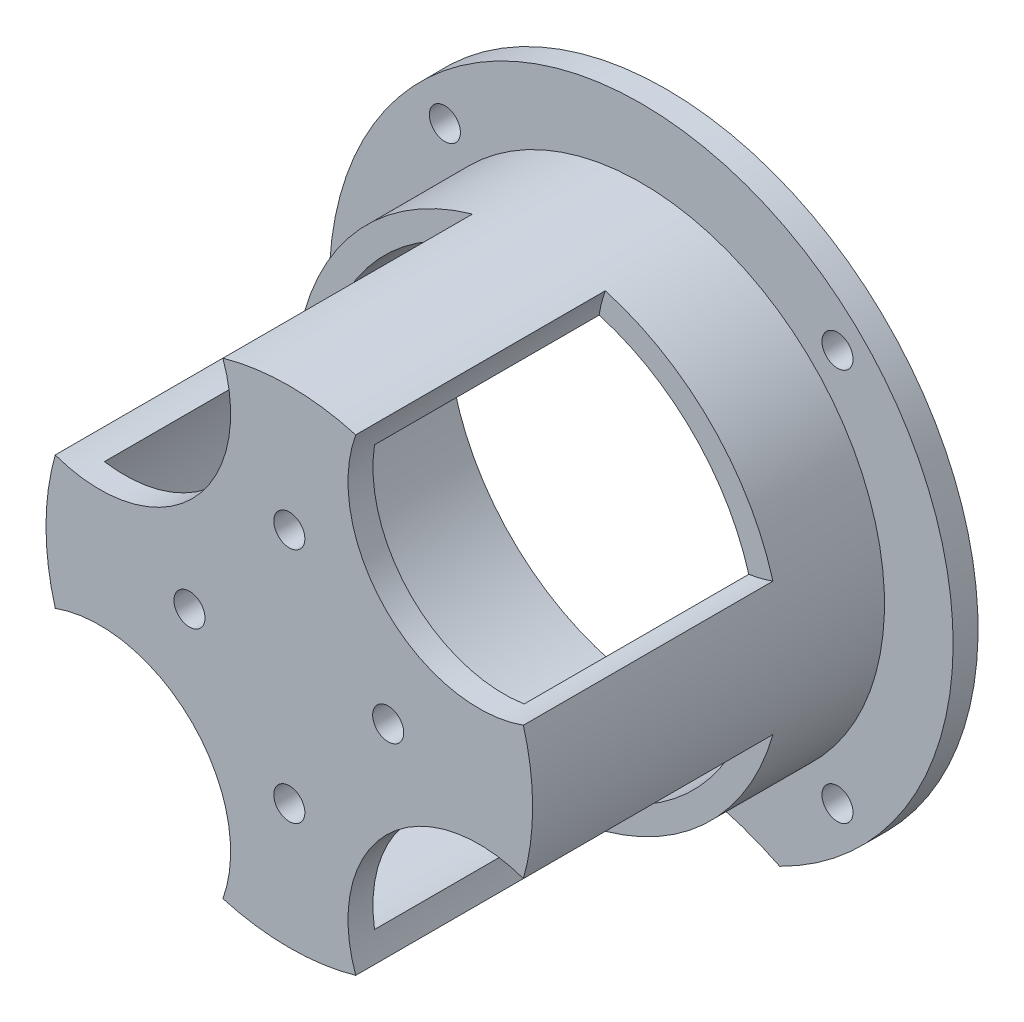
from build123d import *

# Parameters (mm, degrees)
SKETCH_3_R             = 0.6225
SKETCH_3_R_2           = 5.25
CUT_EXTRUDE_1_DEPTH    = 10
EXTRUDE_START          = -1
SKETCH_4_R             = 12.5
SKETCH_4_R_2           = 8.75
EXTRUDE_1_DEPTH        = 1
SKETCH_9_R             = 0.6225
CUT_EXTRUDE_2_DEPTH    = 23.612164868
SKETCH_10_R            = 12.5
CUT_EXTRUDE_1339_DEPTH = 23.612164868
CHAMFER_1434_SIZE      = 0.5


with BuildPart() as part:
    # Эскиз1 → Повернуть1 (revolve)
    with BuildSketch(Plane(origin=(0, 0, 0), x_dir=(1, 0, 0), z_dir=(0, 1, 0))):
        Polygon((8.75, 1), (0, 1), (0, 0), (9.75, 0), (9.75, 15.1), (8.75, 15.1), align=None)
    revolve(axis=Axis((0, 0, 0), (0, 0, -1)))

    # Эскиз3 → Вырез-Вытянуть1 (cut)
    with BuildSketch(Plane.XY):
        with Locations((-4, 0)):
            Circle(SKETCH_3_R)
        with Locations((0, -4.75)):
            Circle(SKETCH_3_R)
        with Locations((3.96157844, 0)):
            Circle(SKETCH_3_R)
        with Locations((0, 4.75)):
            Circle(SKETCH_3_R)
        with Locations((7.601397898, -7.601397898)):
            Circle(SKETCH_3_R_2)
        with Locations((-7.601397898, -7.601397898)):
            Circle(SKETCH_3_R_2)
        with Locations((-7.601397898, 7.601397898)):
            Circle(SKETCH_3_R_2)
        with Locations((7.601397898, 7.601397898)):
            Circle(SKETCH_3_R_2)
    extrude(amount=-CUT_EXTRUDE_1_DEPTH, mode=Mode.SUBTRACT)

    # Эскиз4 → Бобышка-Вытянуть1 (add)
    with BuildSketch(Plane(origin=(0, 0, -15.1), x_dir=(-1, 0, 0), z_dir=(0, 0, -1)).offset(EXTRUDE_START)):
        Circle(SKETCH_4_R)
        with Locations(Location((0, 0, 0), (0, 0, 180))):
            Circle(SKETCH_4_R_2, mode=Mode.SUBTRACT)
    extrude(amount=EXTRUDE_1_DEPTH)

    # Эскиз9 → Вырез-Вытянуть2 (cut, through all)
    with BuildSketch(Plane.XY.offset(-14.1)):
        with Locations((7.866562941, 7.866562941)):
            Circle(SKETCH_9_R)
        with Locations((7.866562941, -7.866562941)):
            Circle(SKETCH_9_R)
        with Locations((-7.866562941, -7.866562941)):
            Circle(SKETCH_9_R)
        with Locations((-7.866562941, 7.866562941)):
            Circle(SKETCH_9_R)
    extrude(amount=-CUT_EXTRUDE_2_DEPTH, mode=Mode.SUBTRACT)

    # Эскиз10 → Cut-Extrude 1339 (cut, through all)
    with BuildSketch(Plane.XY.offset(-14.1)):
        with Locations((0, -22.4)):
            Circle(SKETCH_10_R)
    extrude(amount=-CUT_EXTRUDE_1339_DEPTH, mode=Mode.SUBTRACT)

    # Chamfer 1434
    chamfer_1434_edges = [part.edges().sort_by_distance(p)[0] for p in [
        (0, -9.9, -15.1),
    ]]
    chamfer(chamfer_1434_edges, length=CHAMFER_1434_SIZE)


solid = part.part
